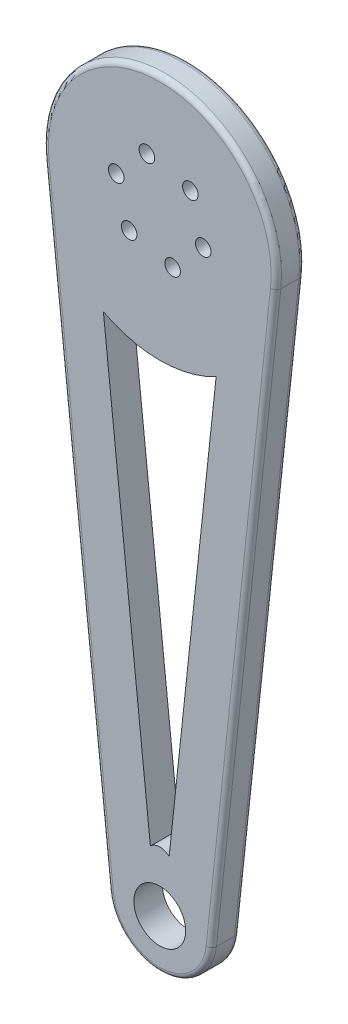
from build123d import *

# Parameters (mm, degrees)
EXTRUDE_1_DEPTH     = 11
SKETCH_2_R          = 10
CUT_EXTRUDE_1_DEPTH = 11
FILLET_1_R          = 2
CUT_EXTRUDE_2_DEPTH = 20
SKETCH_6_R          = 2
CUT_EXTRUDE_4_DEPTH = 33
SKETCH_7_R          = 3
CUT_EXTRUDE_5_DEPTH = 5


with BuildPart() as part:
    # 草图1 → 凸台-拉伸1 (new body)
    with BuildSketch(Plane.XY):
        with BuildLine():
            Line((-44.744635323, -4.787234043), (-19.886504588, -237.127659574))
            ThreePointArc((-19.886504588, -237.127659574), (0, -255), (19.886504588, -237.127659574))
            Line((19.886504588, -237.127659574), (44.744635323, -4.787234043))
            ThreePointArc((44.744635323, -4.787234043), (0, 45), (-44.744635323, -4.787234043))
        make_face()
    extrude(amount=EXTRUDE_1_DEPTH)

    # 草图2 → 切除-拉伸1 (cut)
    with BuildSketch(Plane(origin=(0, 0, 0), x_dir=(-1, 0, 0), z_dir=(0, 0, -1))):
        with Locations((0, -235.836034695)):
            Circle(SKETCH_2_R)
    extrude(amount=-CUT_EXTRUDE_1_DEPTH, mode=Mode.SUBTRACT)

    # 圆角1
    fillet_1_edges = [part.edges().sort_by_distance(p)[0] for p in [
        (0, -255, 11),
        (32.315569956, -120.957446809, 11),
        (0, 45, 11),
        (32.315569956, -120.957446809, 0),
        (0, -255, 0),
        (-32.315569956, -120.957446809, 0),
        (0, 45, 0),
        (-32.315569956, -120.957446809, 11),
    ]]
    fillet(fillet_1_edges, radius=FILLET_1_R)

    # 草图4 → 切除-拉伸2 (cut)
    with BuildSketch(Plane(origin=(0, 0, 0), x_dir=(-1, 0, 0), z_dir=(0, 0, -1))):
        with BuildLine():
            Line((-21.759824224, -44.682312886), (-3.625991278, -214.173032358))
            ThreePointArc((-3.625991278, -214.173032358), (0.015295132, -212.723088949), (3.615338262, -214.272602446))
            Line((3.615338262, -214.272602446), (21.759824224, -44.682312886))
            ThreePointArc((21.759824224, -44.682312886), (0, -50.060383894), (-21.759824224, -44.682312886))
        make_face()
    extrude(amount=-CUT_EXTRUDE_2_DEPTH, mode=Mode.SUBTRACT)

    # 草图6 → 切除-拉伸4 (cut)
    with BuildSketch(Plane.XY.offset(11)):
        with Locations((-16.789244382, 3.960274368)):
            Circle(SKETCH_6_R)
        with Locations((-4.964923982, 16.52004933)):
            Circle(SKETCH_6_R)
        with Locations((11.8243204, 12.559774961)):
            Circle(SKETCH_6_R)
        with Locations((16.789244382, -3.960274368)):
            Circle(SKETCH_6_R)
        with Locations((4.964923982, -16.52004933)):
            Circle(SKETCH_6_R)
        with Locations((-11.8243204, -12.559774961)):
            Circle(SKETCH_6_R)
    extrude(amount=-CUT_EXTRUDE_4_DEPTH, mode=Mode.SUBTRACT)

    # 草图7 → 切除-拉伸5 (cut)
    with BuildSketch(Plane.XY.offset(11)):
        with Locations((-4.964923982, 16.52004933)):
            Circle(SKETCH_7_R)
        with Locations((11.8243204, 12.559774961)):
            Circle(SKETCH_7_R)
        with Locations((16.789244382, -3.960274368)):
            Circle(SKETCH_7_R)
        with Locations((4.964923982, -16.52004933)):
            Circle(SKETCH_7_R)
        with Locations((-11.8243204, -12.559774961)):
            Circle(SKETCH_7_R)
        with Locations((-16.789244382, 3.960274368)):
            Circle(SKETCH_7_R)
    extrude(amount=-CUT_EXTRUDE_5_DEPTH, mode=Mode.SUBTRACT)


solid = part.part
